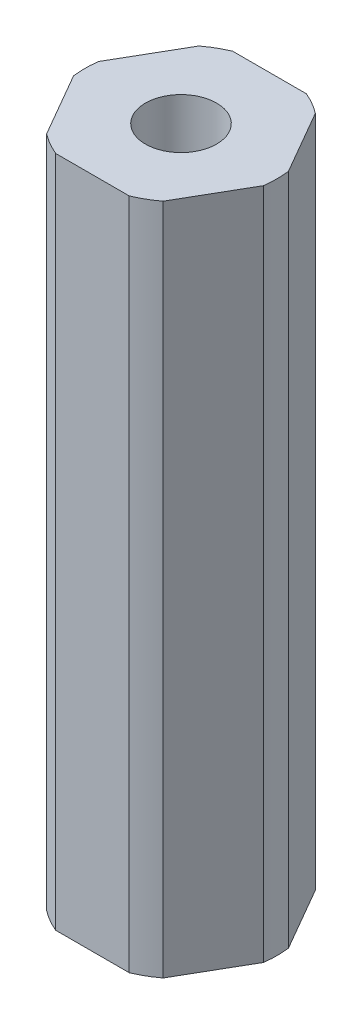
from build123d import *

# Parameters (mm, degrees)
SKETCH1_R           = 2.5527
BOSS_EXTRUDE1_DEPTH = 24.13


with BuildPart() as part:
    # Sketch1 → Boss-Extrude1 (new, symmetric)
    with BuildSketch(Plane(origin=(0, 0, 0), x_dir=(1, 0, 0), z_dir=(0, 1, 0))):
        with BuildLine():
            ThreePointArc((2.637015474, -6.35), (3.43789, -5.954600151), (4.180753577, -5.45872239))
            Line((4.180753577, -5.45872239), (6.817769051, -0.89127761))
            ThreePointArc((6.817769051, -0.89127761), (6.861261935, -0.446581753), (6.87578, 0))
            ThreePointArc((6.87578, 0), (6.861261935, 0.446581753), (6.817769051, 0.89127761))
            Line((6.817769051, 0.89127761), (4.180753577, 5.45872239))
            ThreePointArc((4.180753577, 5.45872239), (3.43789, 5.954600151), (2.637015474, 6.35))
            Line((2.637015474, 6.35), (-2.637015474, 6.35))
            ThreePointArc((-2.637015474, 6.35), (-3.43789, 5.954600151), (-4.180753577, 5.45872239))
            Line((-4.180753577, 5.45872239), (-6.817769051, 0.89127761))
            ThreePointArc((-6.817769051, 0.89127761), (-6.87578, 0), (-6.817769051, -0.89127761))
            Line((-6.817769051, -0.89127761), (-4.180753577, -5.45872239))
            ThreePointArc((-4.180753577, -5.45872239), (-3.43789, -5.954600151), (-2.637015474, -6.35))
            Line((-2.637015474, -6.35), (2.637015474, -6.35))
        make_face()
        with Locations(Location((0, 0, 0), (0, 0, 90))):
            Circle(SKETCH1_R, mode=Mode.SUBTRACT)
    extrude(amount=BOSS_EXTRUDE1_DEPTH, both=True)


solid = part.part
